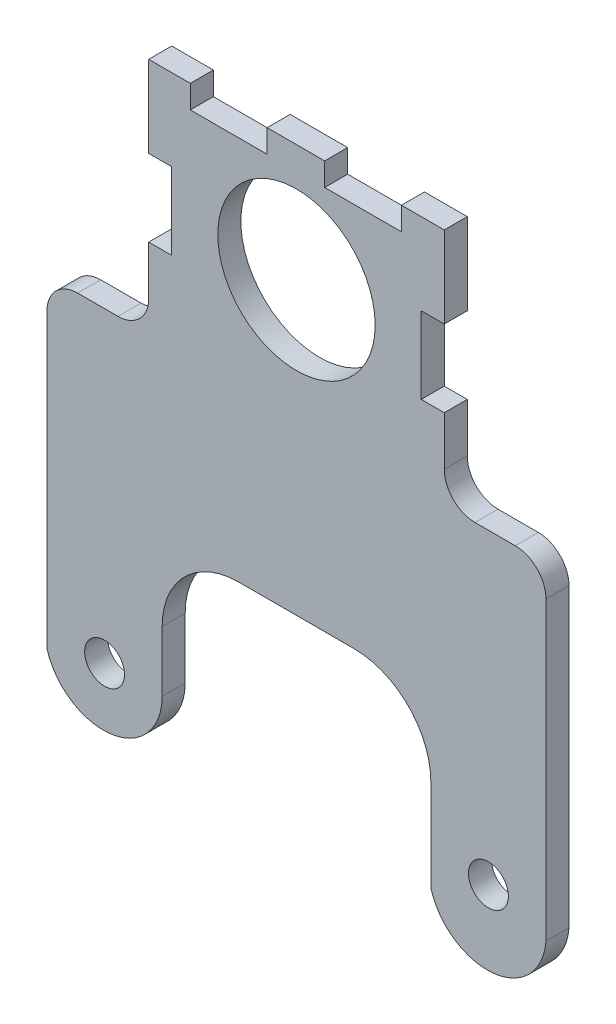
from build123d import *

# Parameters (mm, degrees)
SKETCH1_R           = 2.6
SKETCH1_R_2         = 10.25
BOSS_EXTRUDE1_DEPTH = 3
SKETCH2_W           = 3
SKETCH2_H           = 10
SKETCH2_W_2         = 10
SKETCH2_H_2         = 3
CUT_EXTRUDE1_DEPTH  = 3


with BuildPart() as part:
    # Sketch1 → Boss-Extrude1 (new body)
    with BuildSketch(Plane.XY):
        with BuildLine():
            Line((-32.5, -1.160301848), (-32.5, -34.265434942))
            ThreePointArc((-32.5, -34.265434942), (-24.085532921, -39.728848894), (-17.5, -32.160301848))
            Line((-17.5, -32.160301848), (-17.5, -24.27061763))
            ThreePointArc((-17.5, -24.27061763), (-14.571067812, -17.199549819), (-7.5, -14.27061763))
            Line((-7.5, -14.27061763), (7.5, -14.27061763))
            ThreePointArc((7.5, -14.27061763), (14.571067812, -17.199549819), (17.5, -24.27061763))
            Line((17.5, -24.27061763), (17.5, -32.160301848))
            Line((17.5, -32.160301848), (17.5, -36.245484302))
            ThreePointArc((17.5, -36.245484302), (25.631797985, -41.813464149), (32.5, -34.745484302))
            Line((32.5, -34.745484302), (32.5, -33.660301848))
            Line((32.5, -33.660301848), (32.5, -1.160301848))
            Line((32.5, -1.160301848), (32.5, 3.839698152))
            ThreePointArc((32.5, 3.839698152), (31.328427125, 6.668125276), (28.5, 7.839698152))
            Line((28.5, 7.839698152), (23.25, 7.839698152))
            ThreePointArc((23.25, 7.839698152), (20.421572875, 9.011271027), (19.25, 11.839698152))
            Line((19.25, 11.839698152), (19.25, 38.839698152))
            Line((19.25, 38.839698152), (-19.25, 38.839698152))
            Line((-19.25, 38.839698152), (-19.25, 11.839698152))
            ThreePointArc((-19.25, 11.839698152), (-20.421572875, 9.011271027), (-23.25, 7.839698152))
            Line((-23.25, 7.839698152), (-28.5, 7.839698152))
            ThreePointArc((-28.5, 7.839698152), (-31.328427125, 6.668125276), (-32.5, 3.839698152))
            Line((-32.5, 3.839698152), (-32.5, 3.273112401))
            Line((-32.5, 3.273112401), (-32.5, -1.160301848))
        make_face()
        with Locations((-25, -32.160301848)):
            Circle(SKETCH1_R, mode=Mode.SUBTRACT)
        with Locations((25, -32.160301848)):
            Circle(SKETCH1_R, mode=Mode.SUBTRACT)
        with Locations((0, 23.589698152)):
            Circle(SKETCH1_R_2, mode=Mode.SUBTRACT)
    extrude(amount=BOSS_EXTRUDE1_DEPTH)

    # Sketch2 → Cut-Extrude1 (cut)
    with BuildSketch(Plane.XY.offset(3)):
        with Locations((-17.75, 23.22062572)):
            Rectangle(SKETCH2_W, SKETCH2_H)
        with Locations((-8.827421787, 37.339698152)):
            Rectangle(SKETCH2_W_2, SKETCH2_H_2)
        with Locations((8.672578213, 37.339698152)):
            Rectangle(SKETCH2_W_2, SKETCH2_H_2)
        with Locations((17.75, 23.22062572)):
            Rectangle(SKETCH2_W, SKETCH2_H)
    extrude(amount=-CUT_EXTRUDE1_DEPTH, mode=Mode.SUBTRACT)


solid = part.part
